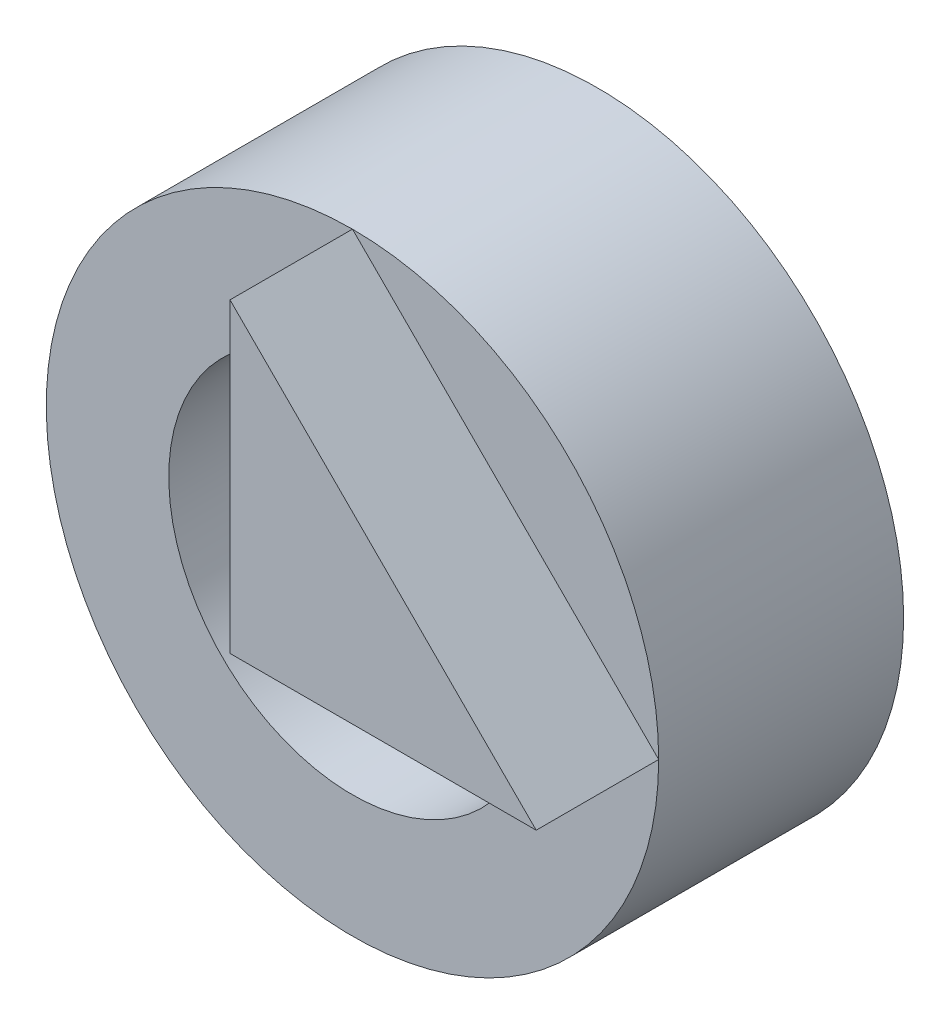
from build123d import *

# Parameters (mm, degrees)
ESQUISSE1_R        = 2.5
ESQUISSE1_R_2      = 1.5
BOSS_EXTRU_1_DEPTH = 2
BOSS_EXTRU_2_DEPTH = 1


with BuildPart() as part:
    # Esquisse1 → Boss.-Extru.1 (new body)
    with BuildSketch(Plane.XY):
        Circle(ESQUISSE1_R)
        Circle(ESQUISSE1_R_2, mode=Mode.SUBTRACT)
    extrude(amount=BOSS_EXTRU_1_DEPTH)

    # Esquisse2 → Boss.-Extru.2 (add)
    with BuildSketch(Plane.XY.offset(2)):
        Polygon((0, 0), (0, 2.5), (2.5, 0), align=None)
    extrude(amount=BOSS_EXTRU_2_DEPTH)


solid = part.part
